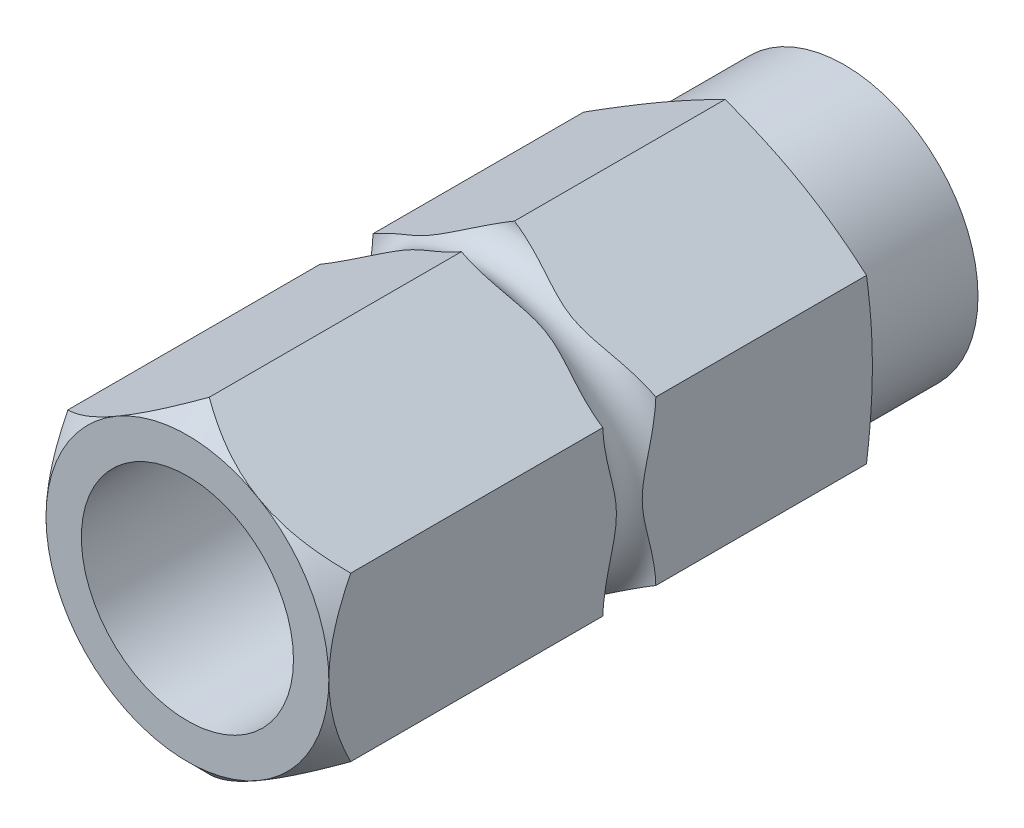
from build123d import *

# Parameters (mm, degrees)
SKETCH1_R      = 9.525
EXTRUDE1_DEPTH = 59
SKETCH2_R      = 2.38125


with BuildPart() as part:
    # Sketch1 → Extrude1 (new body)
    with BuildSketch(Plane.XY):
        Polygon((-12.7, 7.332348419), (-12.7, -7.332348419), (0, -14.664696837), (12.7, -7.332348419), (12.7, 7.332348419), (0, 14.664696837), align=None)
        Circle(SKETCH1_R, mode=Mode.SUBTRACT)
    extrude(amount=-EXTRUDE1_DEPTH)

    # Sketch2 → Cut-Revolve3 (revolve, cut)
    with BuildSketch(Plane(origin=(0, 0, 0), x_dir=(0, 0, -1), z_dir=(1, 0, 0)), mode=Mode.PRIVATE) as cut_revolve3_sk:
        Polygon((59, 14.664696837), (48.285996634, 14.664696837), (49, 12), (59, 12), align=None)
        Polygon((1.964696837, 14.664696837), (0, 14.664696837), (0, 12.7), align=None)
        with Locations((26.9875, 14.78125)):
            Circle(SKETCH2_R)
    revolve(cut_revolve3_sk.sketch.rotate(Axis((0, 0, 0), (0, 0, -1)), 90), axis=Axis((0, 0, 0), (0, 0, -1)), mode=Mode.SUBTRACT)


solid = part.part
